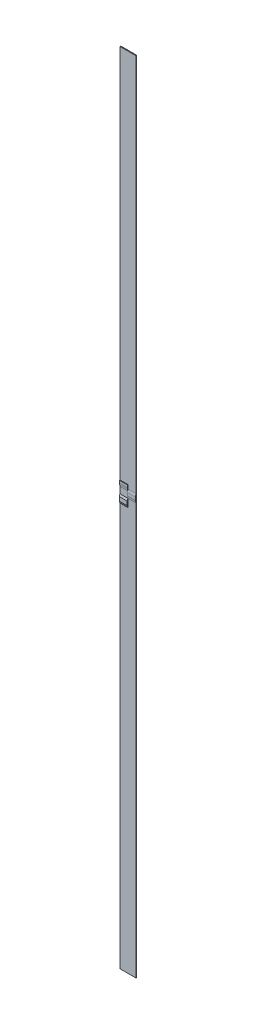
from build123d import *

# Parameters (mm, degrees)
BOSS_EXTRUDE1_DEPTH = 100
BOSS_EXTRUDE2_DEPTH = 1000
BOSS_EXTRUDE3_DEPTH = 1000


with BuildPart() as part:
    # Sketch1 → Boss-Extrude1 (new body)
    with BuildSketch(Plane.XY):
        Polygon((0, 50000), (0, 0), (0, -50000), (1000, -50000), (1000, 50000), align=None)
    extrude(amount=BOSS_EXTRUDE1_DEPTH)

    # Sketch2 → Boss-Extrude2 (add)
    with BuildSketch(Plane.ZY):
        Polygon((100, -50000), (100, 500), (190, 750), (190, 1250), (100, 1500), (100, 2300), (180, 2700), (180, 3000), (100, 3000), (100, 50000), (0, 50000), (0, -50000), align=None)
    extrude(amount=BOSS_EXTRUDE2_DEPTH)

    # Sketch3 → Boss-Extrude3 (add)
    with BuildSketch(Plane(origin=(1000, 0, 0), x_dir=(0, 0, -1), z_dir=(1, 0, 0))):
        Polygon((-100, 1500), (-160, 1800), (-160, 2200), (-100, 2500), align=None)
    extrude(amount=-BOSS_EXTRUDE3_DEPTH)


solid = part.part
